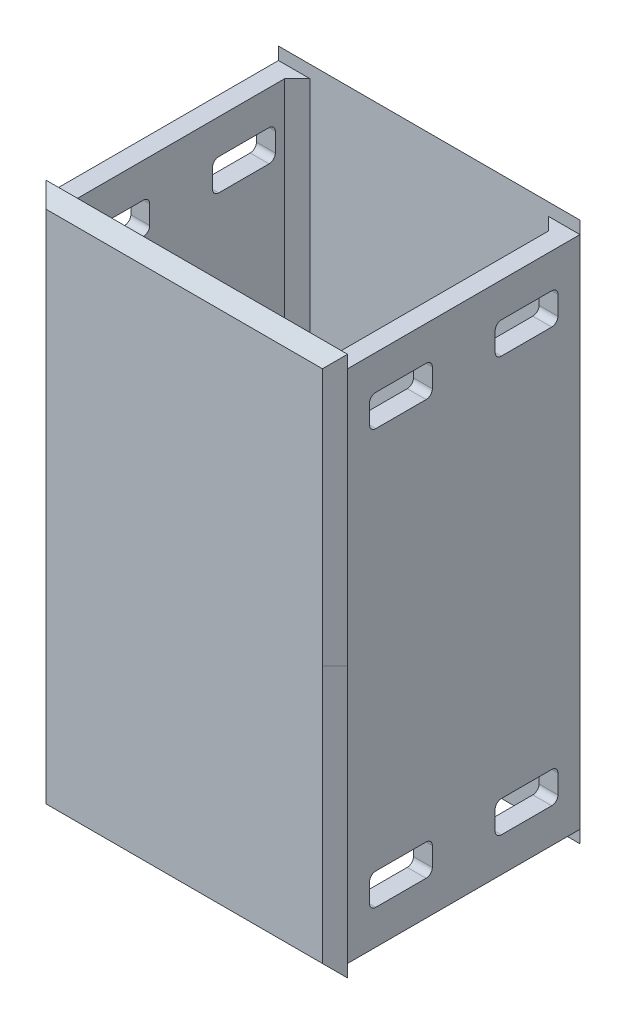
from build123d import *

# Parameters (mm, degrees)
SKETCH2_W                       = 20.999999999999993
SKETCH2_H                       = 18.500000000000007
BOSS_EXTRUDE2_DEPTH             = 20.5
BOSS_EXTRUDE5_REACH             = 27.871
BOSS_EXTRUDE5_DIRECTION_2_REACH = 27.871
CUT_EXTRUDE1_DEPTH              = 34.81290434139014
CHAMFER1_SIZE                   = 1
CHAMFER1_OF_MIRROR1_SIZE        = 1


with BuildPart() as part:
    # Sketch2 → Boss-Extrude2 (new body)
    with BuildSketch(Plane(origin=(0, 0, 0), x_dir=(1, 0, 0), z_dir=(0, 1, 0))):
        Polygon((-11.999999999999991, -10.249999999999988), (12, -10.249999999999982), (11.999999999999998, 10.249999999999982), (-11.999999999999991, 10.249999999999979), align=None)
        Rectangle(SKETCH2_W, SKETCH2_H, mode=Mode.SUBTRACT)
    boss_extrude2 = extrude(amount=BOSS_EXTRUDE2_DEPTH)

    # Boss-Extrude5: up to this face of the body (flat: up to its plane)
    boss_extrude5_end = Plane(part.part.faces().sort_by_distance((12, 10.25, 0))[0])
    # Sketch4 → Boss-Extrude5 (add, up to the picked face)
    with BuildSketch(Plane(origin=(0, 0, 0), x_dir=(0, 0, -1), z_dir=(1, 0, 0)), mode=Mode.PRIVATE) as boss_extrude5_sk1:
        Polygon((-10.249999999999982, 20.5), (-9.249999999999988, 21.5), (-9.249999999999988, 20.5), align=None)
    boss_extrude5_tool1 = split(extrude(boss_extrude5_sk1.sketch, amount=BOSS_EXTRUDE5_REACH, mode=Mode.PRIVATE), bisect_by=boss_extrude5_end, keep=Keep.BOTH, mode=Mode.PRIVATE)
    # Sketch4 → Boss-Extrude5 (add, up to the picked face)
    with BuildSketch(Plane(origin=(0, 0, 0), x_dir=(0, 0, -1), z_dir=(1, 0, 0)), mode=Mode.PRIVATE) as boss_extrude5_sk2:
        Polygon((10.25, 20.500000000000004), (9.250000000000005, 21.500000000000004), (9.250000000000005, 20.500000000000004), align=None)
    boss_extrude5_tool2 = split(extrude(boss_extrude5_sk2.sketch, amount=BOSS_EXTRUDE5_REACH, mode=Mode.PRIVATE), bisect_by=boss_extrude5_end, keep=Keep.BOTH, mode=Mode.PRIVATE)
    boss_extrude5_1 = boss_extrude5_tool1.solids().sort_by(Axis((0, 20.833333, 9.583333), (1, 0, 0)))[0]
    add(boss_extrude5_1)
    boss_extrude5_2 = boss_extrude5_tool2.solids().sort_by(Axis((0, 20.833333, -9.583333), (1, 0, 0)))[0]
    add(boss_extrude5_2)
    boss_extrude5 = boss_extrude5_1 + boss_extrude5_2  # Boss-Extrude5 as one shape, for the pattern or mirror that repeats it

    # Boss-Extrude5 direction 2: up to this face of the body (flat: up to its plane)
    boss_extrude5_direction_2_end = Plane(part.part.faces().sort_by_distance((-12, 10.25, 0))[0])
    # Sketch4 → Boss-Extrude5 direction 2 (add, up to the picked face)
    with BuildSketch(Plane(origin=(0, 0, 0), x_dir=(0, 0, -1), z_dir=(1, 0, 0)), mode=Mode.PRIVATE) as boss_extrude5_direction_2_sk1:
        Polygon((-10.249999999999982, 20.5), (-9.249999999999988, 21.5), (-9.249999999999988, 20.5), align=None)
    boss_extrude5_direction_2_tool1 = split(extrude(boss_extrude5_direction_2_sk1.sketch, amount=-BOSS_EXTRUDE5_DIRECTION_2_REACH, mode=Mode.PRIVATE), bisect_by=boss_extrude5_direction_2_end, keep=Keep.BOTH, mode=Mode.PRIVATE)
    # Sketch4 → Boss-Extrude5 direction 2 (add, up to the picked face)
    with BuildSketch(Plane(origin=(0, 0, 0), x_dir=(0, 0, -1), z_dir=(1, 0, 0)), mode=Mode.PRIVATE) as boss_extrude5_direction_2_sk2:
        Polygon((10.25, 20.500000000000004), (9.250000000000005, 21.500000000000004), (9.250000000000005, 20.500000000000004), align=None)
    boss_extrude5_direction_2_tool2 = split(extrude(boss_extrude5_direction_2_sk2.sketch, amount=-BOSS_EXTRUDE5_DIRECTION_2_REACH, mode=Mode.PRIVATE), bisect_by=boss_extrude5_direction_2_end, keep=Keep.BOTH, mode=Mode.PRIVATE)
    boss_extrude5_direction_2_1 = boss_extrude5_direction_2_tool1.solids().sort_by(Axis((0, 20.833333, 9.583333), (-1, 0, 0)))[0]
    add(boss_extrude5_direction_2_1)
    boss_extrude5_direction_2_2 = boss_extrude5_direction_2_tool2.solids().sort_by(Axis((0, 20.833333, -9.583333), (-1, 0, 0)))[0]
    add(boss_extrude5_direction_2_2)
    boss_extrude5_direction_2 = boss_extrude5_direction_2_1 + boss_extrude5_direction_2_2  # Boss-Extrude5 direction 2 as one shape, for the pattern or mirror that repeats it

    # Sketch5 → Cut-Extrude1 (cut, through all)
    with BuildSketch(Plane(origin=(11.999999999999998, 0, -1.02e-15), x_dir=(0, 0, -1), z_dir=(1, 0, 0))):
        with BuildLine():
            Line((-6.9999999999999885, 17.750000000000004), (-2.9999999999999893, 17.750000000000004))
            ThreePointArc((-2.9999999999999893, 17.750000000000004), (-2.646446609406713, 17.603553390593277), (-2.4999999999999893, 17.25))
            Line((-2.4999999999999893, 17.25), (-2.4999999999999893, 15.75))
            ThreePointArc((-2.4999999999999893, 15.75), (-2.6464466094067154, 15.396446609406727), (-2.9999999999999893, 15.250000000000002))
            Line((-2.9999999999999893, 15.250000000000002), (-6.9999999999999885, 15.250000000000002))
            ThreePointArc((-6.9999999999999885, 15.250000000000002), (-7.353553390593261, 15.396446609406727), (-7.4999999999999885, 15.75))
            Line((-7.4999999999999885, 15.75), (-7.49999999999999, 17.25))
            ThreePointArc((-7.49999999999999, 17.25), (-7.353553390593265, 17.603553390593277), (-6.9999999999999885, 17.750000000000004))
        make_face()
        with BuildLine():
            Line((7.00000000000001, 17.750000000000004), (3.000000000000011, 17.750000000000004))
            ThreePointArc((3.000000000000011, 17.750000000000004), (2.646446609406735, 17.603553390593277), (2.500000000000011, 17.25))
            Line((2.500000000000011, 17.25), (2.500000000000011, 15.75))
            ThreePointArc((2.500000000000011, 15.75), (2.6464466094067376, 15.396446609406725), (3.000000000000012, 15.250000000000002))
            Line((3.000000000000012, 15.250000000000002), (7.0000000000000115, 15.250000000000004))
            ThreePointArc((7.0000000000000115, 15.250000000000004), (7.353553390593284, 15.39644660940673), (7.500000000000011, 15.750000000000004))
            Line((7.500000000000011, 15.750000000000004), (7.500000000000012, 17.250000000000004))
            ThreePointArc((7.500000000000012, 17.250000000000004), (7.3535533905932855, 17.603553390593277), (7.00000000000001, 17.750000000000004))
        make_face()
    cut_extrude1 = extrude(amount=-CUT_EXTRUDE1_DEPTH, mode=Mode.SUBTRACT)

    # Chamfer1
    chamfer1_edges = [part.edges().sort_by_distance(p)[0] for p in [
        (-11.999999999999991, 10.25, -10.249999999999979),
        (11.999999999999998, 10.25, -10.249999999999982),
        (12, 10.25, 10.249999999999982),
        (-11.999999999999991, 10.25, 10.249999999999988),
        (10.5, 10.25, -9.250000000000018),
        (-10.499999999999991, 10.25, -9.250000000000018),
        (-10.499999999999991, 10.25, 9.249999999999988),
        (10.5, 10.25, 9.249999999999988),
    ]]
    chamfer(chamfer1_edges, length=CHAMFER1_SIZE)


with BuildPart() as mirror1_1:
    # Mirror1: Boss-Extrude2, Boss-Extrude5, Boss-Extrude5 direction 2 across plane
    add(boss_extrude2.mirror(Plane.ZX))
    add(boss_extrude5.mirror(Plane.ZX))
    add(boss_extrude5_direction_2.mirror(Plane.ZX))

    # Mirror1 2: Cut-Extrude1 across plane
    add(cut_extrude1.mirror(Plane.ZX), mode=Mode.SUBTRACT)

    # Chamfer1 of Mirror1
    chamfer1_of_mirror1_edges = [mirror1_1.edges().sort_by_distance(p)[0] for p in [
        (-11.999999999999991, -10.25, -10.249999999999979),
        (11.999999999999998, -10.25, -10.249999999999982),
        (12, -10.25, 10.249999999999982),
        (-11.999999999999991, -10.25, 10.249999999999988),
        (10.5, -10.25, -9.250000000000018),
        (-10.499999999999991, -10.25, -9.250000000000018),
        (-10.499999999999991, -10.25, 9.249999999999988),
        (10.5, -10.25, 9.249999999999988),
    ]]
    chamfer(chamfer1_of_mirror1_edges, length=CHAMFER1_OF_MIRROR1_SIZE)


with BuildPart() as part_1:
    add(part.part)

    # Mirror1 united with what the copies touc: union Mirror1_1
    add(mirror1_1.part)


solid = part_1.part
